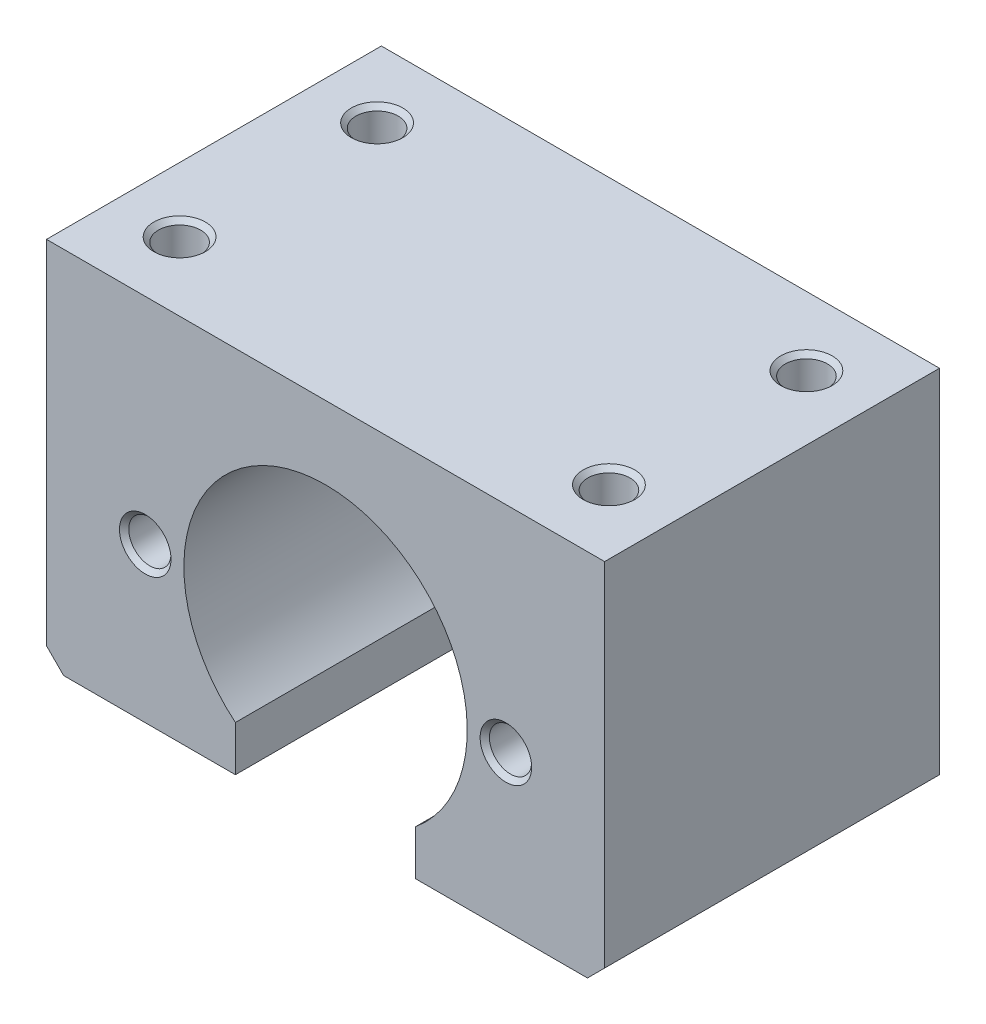
from build123d import *

# Parameters (mm, degrees)
EXTRUDE_1_DEPTH      = 19.5
EXTRUDE_1_DEPTH_BACK = 19.5


with BuildPart() as part:
    # 草图1 → 凸台-拉伸1 (new, two sides: drawn at the far end of the back side and taken through both)
    with BuildSketch(Plane.XY.offset(-EXTRUDE_1_DEPTH_BACK)):
        with BuildLine():
            Line((-32.5, 25), (-32.5, -16))
            Line((-32.5, -16), (-30.5, -18))
            Line((-30.5, -18), (-10.5, -18))
            Line((-10.5, -18), (-10.5, -12.727922061))
            ThreePointArc((-10.5, -12.727922061), (0, 16.5), (10.5, -12.727922061))
            Line((10.5, -12.727922061), (10.5, -18))
            Line((10.5, -18), (30.5, -18))
            Line((30.5, -18), (32.5, -16))
            Line((32.5, -16), (32.5, 25))
            Line((32.5, 25), (-32.5, 25))
        make_face()
    extrude(amount=EXTRUDE_1_DEPTH + EXTRUDE_1_DEPTH_BACK)

    # 草图2 → 切除-旋转1 (revolve, cut)
    with BuildSketch(Plane(origin=(21, 0, 0), x_dir=(0, 0, -1), z_dir=(1, 0, 0))):
        Polygon((-19.5, 0), (-19.5, 3), (-18.9585, 2.4585), (-7.5, 2.4585), (-6.080584363, 0), align=None)
    revolve(axis=Axis((21, 0, 6.080584363), (0, 0, 1)), mode=Mode.SUBTRACT)

    # 草图3 → 切除-旋转2 (revolve, cut)
    with BuildSketch(Plane(origin=(-21, 0, 0), x_dir=(0, 0, -1), z_dir=(1, 0, 0))):
        Polygon((-19.5, 0), (-19.5, 3), (-18.9585, 2.4585), (-7.5, 2.4585), (-6.080584363, 0), align=None)
    revolve(axis=Axis((-21, 0, 6.080584363), (0, 0, 1)), mode=Mode.SUBTRACT)

    # 草图4 → 切除-旋转3 (revolve, cut)
    with BuildSketch(Plane(origin=(25, 0, 0), x_dir=(0, 0, -1), z_dir=(1, 0, 0))):
        Polygon((-11.5, 25), (-8.5, 25), (-9.0415, 24.4585), (-9.0415, 11), (-11.5, 9.580584363), align=None)
    revolve(axis=Axis((25, 9.580584363, 11.5), (0, 1, 0)), mode=Mode.SUBTRACT)

    # 草图5 → 切除-旋转4 (revolve, cut)
    with BuildSketch(Plane(origin=(25, 0, 0), x_dir=(0, 0, -1), z_dir=(1, 0, 0))):
        Polygon((11.5, 25), (14.5, 25), (13.9585, 24.4585), (13.9585, 11), (11.5, 9.580584363), align=None)
    revolve(axis=Axis((25, 9.580584363, -11.5), (0, 1, 0)), mode=Mode.SUBTRACT)

    # 草图6 → 切除-旋转5 (revolve, cut)
    with BuildSketch(Plane(origin=(-25, 0, 0), x_dir=(0, 0, -1), z_dir=(1, 0, 0))):
        Polygon((-11.5, 25), (-8.5, 25), (-9.0415, 24.4585), (-9.0415, 11), (-11.5, 9.580584363), align=None)
    revolve(axis=Axis((-25, 9.580584363, 11.5), (0, 1, 0)), mode=Mode.SUBTRACT)

    # 草图7 → 切除-旋转6 (revolve, cut)
    with BuildSketch(Plane(origin=(-25, 0, 0), x_dir=(0, 0, -1), z_dir=(1, 0, 0))):
        Polygon((11.5, 25), (14.5, 25), (13.9585, 24.4585), (13.9585, 11), (11.5, 9.580584363), align=None)
    revolve(axis=Axis((-25, 9.580584363, -11.5), (0, 1, 0)), mode=Mode.SUBTRACT)


solid = part.part
